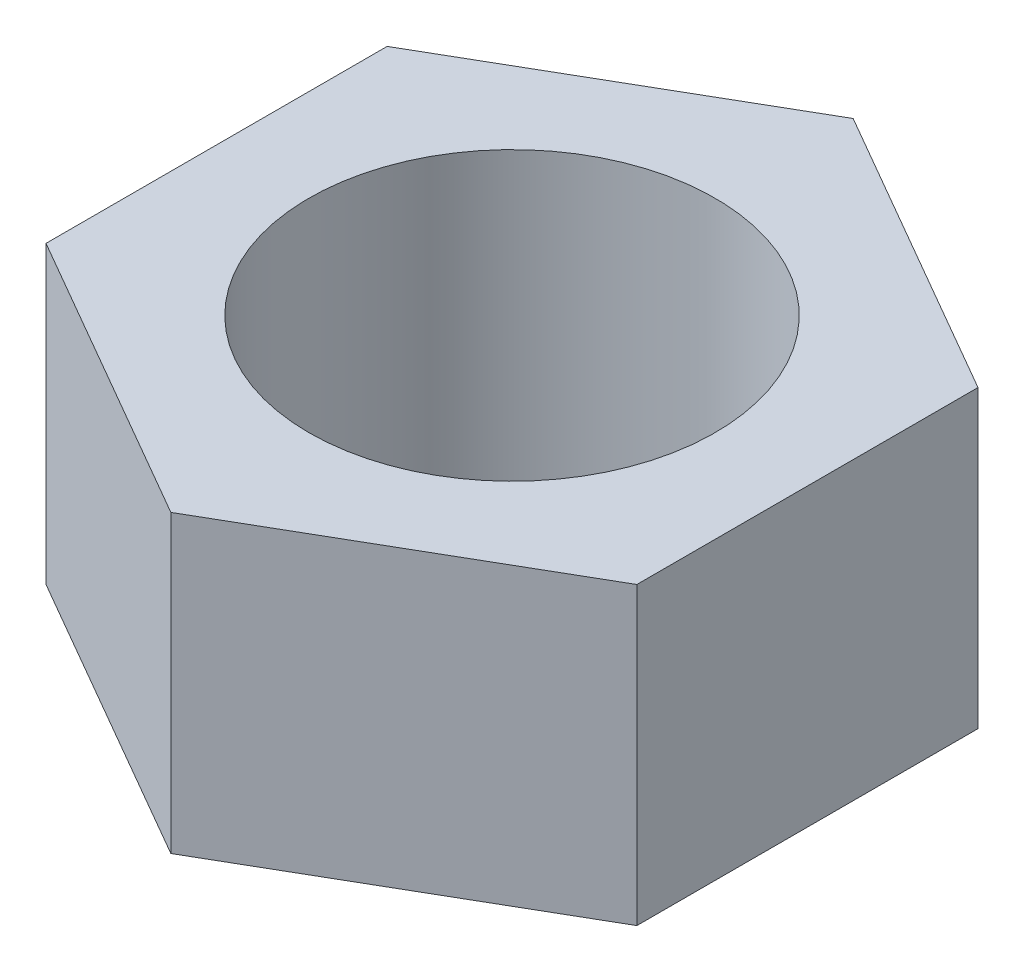
from build123d import *

# Parameters (mm, degrees)
BODY_DEPTH           = 4
M5_CLEARANCE_HOLE1_D = 5.5


with BuildPart() as part:
    # Sketch1 → Body (new body)
    with BuildSketch(Plane(origin=(0, 0, 0), x_dir=(1, 0, 0), z_dir=(0, 1, 0))):
        Polygon((0, 4.618802154), (-4, 2.309401077), (-4, -2.309401077), (0, -4.618802154), (4, -2.309401077), (4, 2.309401077), align=None)
    extrude(amount=BODY_DEPTH)

    # M5 Clearance Hole1 (through all)
    with Locations(Plane(origin=(0, 4, 0), x_dir=(1, 0, 0), z_dir=(0, 1, 0))):
        with Locations((0, 0)):
            Hole(M5_CLEARANCE_HOLE1_D / 2)


solid = part.part
